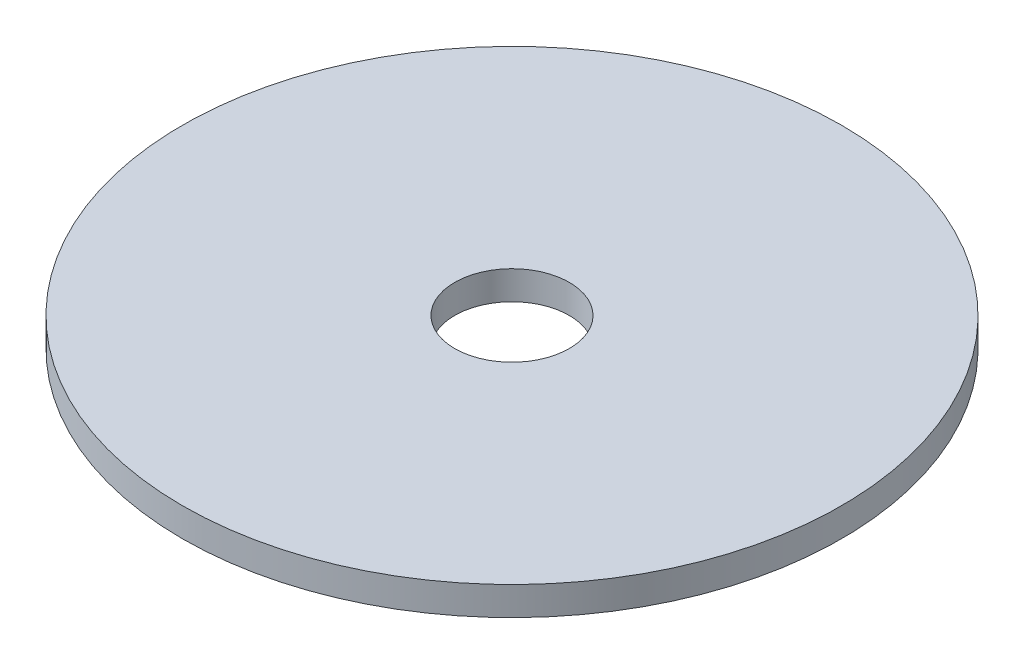
from build123d import *

# Parameters (mm, degrees)
ESQUISSE1_R             = 46
BOSS_EXTRU_1_DEPTH      = 4
ESQUISSE2_R             = 8
ENL_V_MAT_EXTRU_1_DEPTH = 4.5
ENL_V_MAT_EXTRU_2_DEPTH = 2


with BuildPart() as part:
    # Esquisse1 → Boss.-Extru.1 (new body)
    with BuildSketch(Plane(origin=(0, 0, 0), x_dir=(1, 0, 0), z_dir=(0, 1, 0))):
        with Locations(Location((0, 0, 0), (0, 0, 270))):
            Circle(ESQUISSE1_R)
    extrude(amount=BOSS_EXTRU_1_DEPTH)

    # Esquisse2 → Enlèv. mat.-Extru.1 (cut)
    with BuildSketch(Plane(origin=(0, 4, 0), x_dir=(1, 0, 0), z_dir=(0, 1, 0))):
        with Locations(Location((0, 0, 0), (0, 0, 270))):
            Circle(ESQUISSE2_R)
    extrude(amount=-ENL_V_MAT_EXTRU_1_DEPTH, mode=Mode.SUBTRACT)

    # Esquisse3 → Enlèv. mat.-Extru.2 (cut)
    with BuildSketch(Plane(origin=(0, 0, 0), x_dir=(-1, 0, 0), z_dir=(0, -1, 0))):
        with BuildLine():
            ThreePointArc((0, -32), (22.627416998, -22.627416998), (32, 0))
            ThreePointArc((32, 0), (31, 0.918210565), (30, 0))
            ThreePointArc((30, 0), (0, -30), (-30, 0))
            ThreePointArc((-30, 0), (-31, 1), (-32, 0))
            ThreePointArc((-32, 0), (-22.627416998, -22.627416998), (0, -32))
        make_face()
    extrude(amount=-ENL_V_MAT_EXTRU_2_DEPTH, mode=Mode.SUBTRACT)


solid = part.part
